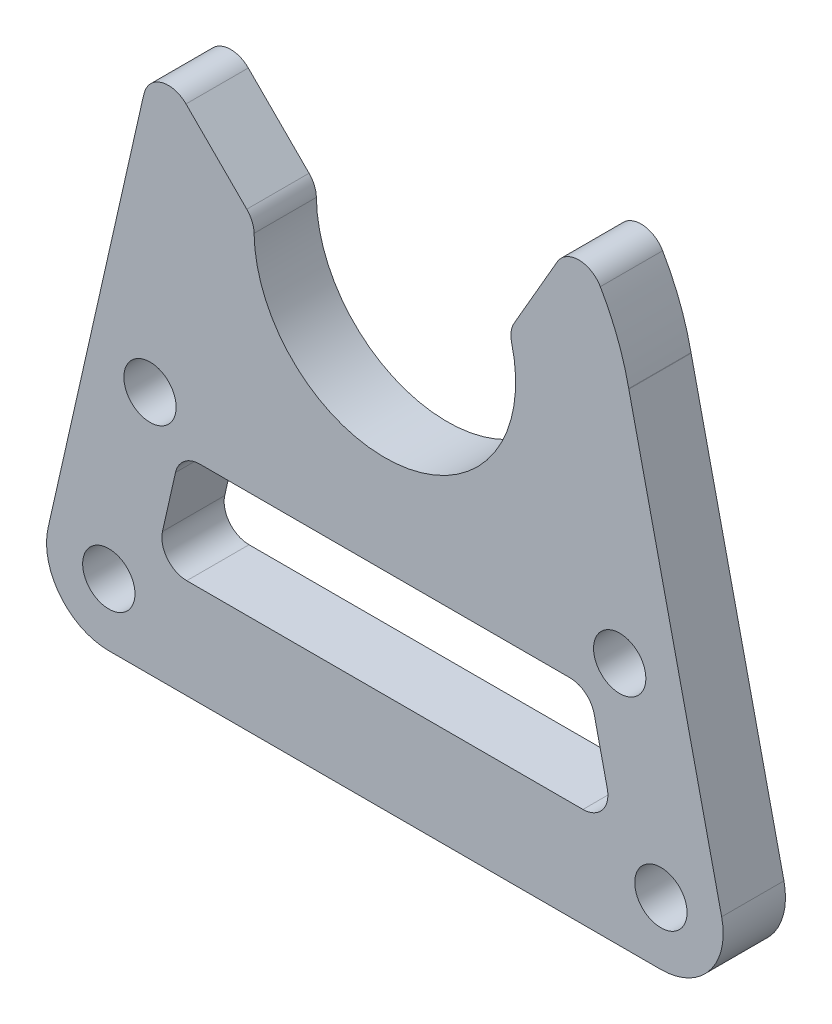
from build123d import *

# Parameters (mm, degrees)
SKETCH_1_R          = 20
SKETCH_1_R_2        = 10.5
EXTRUDE_1_DEPTH     = 5
EXTRUDE_START       = -5
EXTRUDE_2_DEPTH     = 5
FILLET_1_R          = 5
SKETCH_3_R          = 2.1
CUT_EXTRUDE_1_DEPTH = 45.582524906
CUT_EXTRUDE_2_DEPTH = 45.582524906
FILLET_2_R          = 2


with BuildPart() as part:
    # 草图1 → 凸台-拉伸1 (new body)
    with BuildSketch(Plane.XY):
        Circle(SKETCH_1_R)
        Circle(SKETCH_1_R_2, mode=Mode.SUBTRACT)
    extrude(amount=EXTRUDE_1_DEPTH)

    # 草图2 → 凸台-拉伸2 (add)
    with BuildSketch(Plane.XY.offset(5).offset(EXTRUDE_START)):
        with BuildLine():
            Line((-28.415563483, -35), (28.415563483, -35))
            Line((28.415563483, -35), (19.580039782, 4.077013874))
            ThreePointArc((19.580039782, 4.077013874), (19.894732917, 2.049293093), (20, 0))
            ThreePointArc((20, 0), (-2.049293093, -19.894732917), (-19.580039782, 4.077013874))
            Line((-19.580039782, 4.077013874), (-28.415563483, -35))
        make_face()
    extrude(amount=EXTRUDE_2_DEPTH)

    # 圆角1
    fillet_1_edges = [part.edges().sort_by_distance(p)[0] for p in [
        (28.415563483, -35, 2.5),
        (-28.415563483, -35, 2.5),
    ]]
    fillet(fillet_1_edges, radius=FILLET_1_R)

    # 草图3 → 切除-拉伸1 (cut, through all)
    with BuildSketch(Plane.XY.offset(5)):
        with Locations((22.158820427, -30)):
            Circle(SKETCH_3_R)
        with Locations((-22.158820427, -30)):
            Circle(SKETCH_3_R)
        with Locations((-18.850745921, -15.36932527)):
            Circle(SKETCH_3_R)
        with Locations((18.850745921, -15.36932527)):
            Circle(SKETCH_3_R)
        Polygon((-16.453332464, -18.36932527), (16.453332464, -18.36932527), (18.404774593, -27), (-18.404774593, -27), align=None)
    extrude(amount=-CUT_EXTRUDE_1_DEPTH, mode=Mode.SUBTRACT)

    # 草图4 → 切除-拉伸2 (cut, through all)
    with BuildSketch(Plane.XY.offset(5)):
        with BuildLine():
            Line((-2.103165657, 10.287210225), (-1.493384576, 11.343382038))
            Line((-1.493384576, 11.343382038), (-8.331863171, 18.181860633))
            ThreePointArc((-8.331863171, 18.181860633), (-14.142135624, 14.142135624), (-18.181860633, 8.331863171))
            Line((-18.181860633, 8.331863171), (-10.481021364, 0.631023902))
            ThreePointArc((-10.481021364, 0.631023902), (-7.931010296, 6.881066464), (-2.103165657, 10.287210225))
        make_face()
        with BuildLine():
            Line((-8.331863171, 18.181860633), (-1.493384576, 11.343382038))
            Line((-1.493384576, 11.343382038), (3.342150011, 19.718773626))
            ThreePointArc((3.342150011, 19.718773626), (-2.610523844, 19.828897227), (-8.331863171, 18.181860633))
        make_face()
        with BuildLine():
            ThreePointArc((-2.103165657, 10.287210225), (-1.370525018, 10.410171044), (-0.631023902, 10.481021364))
            Line((-0.631023902, 10.481021364), (-1.493384576, 11.343382038))
            Line((-1.493384576, 11.343382038), (-2.103165657, 10.287210225))
        make_face()
        with BuildLine():
            Line((-1.493384576, 11.343382038), (-0.631023902, 10.481021364))
            ThreePointArc((-0.631023902, 10.481021364), (5.879816622, 8.699296321), (9.960568218, 3.322210225))
            Line((9.960568218, 3.322210225), (15.405883886, 12.753773626))
            ThreePointArc((15.405883886, 12.753773626), (10, 17.320508076), (3.342150011, 19.718773626))
            Line((3.342150011, 19.718773626), (-1.493384576, 11.343382038))
        make_face()
    extrude(amount=-CUT_EXTRUDE_2_DEPTH, mode=Mode.SUBTRACT)

    # 圆角2
    fillet_2_edges = [part.edges().sort_by_distance(p)[0] for p in [
        (-19.580039782, 4.077013874, 2.5),
        (19.580039782, 4.077013874, 2.5),
        (-18.404774593, -27, 2.5),
        (-16.453332464, -18.36932527, 2.5),
        (16.453332464, -18.36932527, 2.5),
        (18.404774593, -27, 2.5),
        (9.960568218, 3.322210225, 2.5),
        (-10.481021364, 0.631023902, 2.5),
        (-18.181860633, 8.331863171, 2.5),
        (15.405883886, 12.753773626, 2.5),
    ]]
    fillet(fillet_2_edges, radius=FILLET_2_R)


solid = part.part
